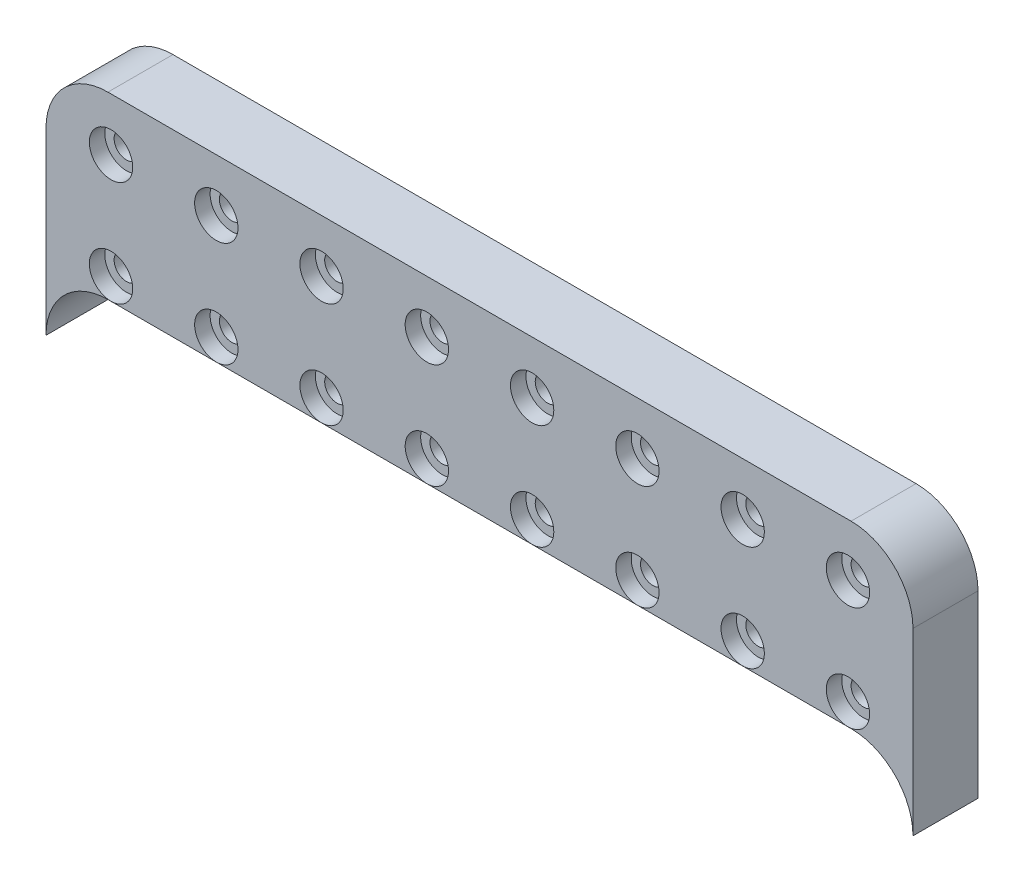
from build123d import *

# Parameters (mm, degrees)
SKIZZE1_W                        = 140
SKIZZE1_H                        = 180
AUFSATZ_LINEAR_AUSTRAGEN1_DEPTH  = 10.5
SKIZZE2_R                        = 3.5
SCHNITT_LINEAR_AUSTRAGEN3_DEPTH  = 2.5
SKIZZE3_R                        = 2
SCHNITT_LINEAR_AUSTRAGEN5_DEPTH  = 229.276696139
VERRUNDUNG1_R                    = 10
SCHNITT_LINEAR_AUSTRAGEN17_DEPTH = 229.276696139


with BuildPart() as part:
    # Skizze1 → Aufsatz-Linear austragen1 (new body)
    with BuildSketch(Plane.XY):
        with Locations((70, 90)):
            Rectangle(SKIZZE1_W, SKIZZE1_H)
    extrude(amount=AUFSATZ_LINEAR_AUSTRAGEN1_DEPTH)

    # Skizze2 → Schnitt-Linear austragen3 (cut)
    with BuildSketch(Plane.XY.offset(10.5)):
        with Locations((10.5, 183.5)):
            Circle(SKIZZE2_R)
        with Locations((27.5, 183.5)):
            Circle(SKIZZE2_R)
        with Locations((44.5, 183.5)):
            Circle(SKIZZE2_R)
        with Locations((61.5, 183.5)):
            Circle(SKIZZE2_R)
        with Locations((78.5, 183.5)):
            Circle(SKIZZE2_R)
        with Locations((95.5, 183.5)):
            Circle(SKIZZE2_R)
        with Locations((112.5, 183.5)):
            Circle(SKIZZE2_R)
        with Locations((129.5, 183.5)):
            Circle(SKIZZE2_R)
        with Locations((27.5, 166.5)):
            Circle(SKIZZE2_R)
        with Locations((44.5, 166.5)):
            Circle(SKIZZE2_R)
        with Locations((61.5, 166.5)):
            Circle(SKIZZE2_R)
        with Locations((78.5, 166.5)):
            Circle(SKIZZE2_R)
        with Locations((95.5, 166.5)):
            Circle(SKIZZE2_R)
        with Locations((112.5, 166.5)):
            Circle(SKIZZE2_R)
        with Locations((129.5, 166.5)):
            Circle(SKIZZE2_R)
        with Locations((27.5, 149.5)):
            Circle(SKIZZE2_R)
        with Locations((44.5, 149.5)):
            Circle(SKIZZE2_R)
        with Locations((61.5, 149.5)):
            Circle(SKIZZE2_R)
        with Locations((78.5, 149.5)):
            Circle(SKIZZE2_R)
        with Locations((95.5, 149.5)):
            Circle(SKIZZE2_R)
        with Locations((112.5, 149.5)):
            Circle(SKIZZE2_R)
        with Locations((129.5, 149.5)):
            Circle(SKIZZE2_R)
        with Locations((27.5, 132.5)):
            Circle(SKIZZE2_R)
        with Locations((44.5, 132.5)):
            Circle(SKIZZE2_R)
        with Locations((61.5, 132.5)):
            Circle(SKIZZE2_R)
        with Locations((78.5, 132.5)):
            Circle(SKIZZE2_R)
        with Locations((95.5, 132.5)):
            Circle(SKIZZE2_R)
        with Locations((112.5, 132.5)):
            Circle(SKIZZE2_R)
        with Locations((129.5, 132.5)):
            Circle(SKIZZE2_R)
        with Locations((27.5, 115.5)):
            Circle(SKIZZE2_R)
        with Locations((44.5, 115.5)):
            Circle(SKIZZE2_R)
        with Locations((61.5, 115.5)):
            Circle(SKIZZE2_R)
        with Locations((78.5, 115.5)):
            Circle(SKIZZE2_R)
        with Locations((95.5, 115.5)):
            Circle(SKIZZE2_R)
        with Locations((112.5, 115.5)):
            Circle(SKIZZE2_R)
        with Locations((129.5, 115.5)):
            Circle(SKIZZE2_R)
        with Locations((27.5, 98.5)):
            Circle(SKIZZE2_R)
        with Locations((44.5, 98.5)):
            Circle(SKIZZE2_R)
        with Locations((61.5, 98.5)):
            Circle(SKIZZE2_R)
        with Locations((78.5, 98.5)):
            Circle(SKIZZE2_R)
        with Locations((95.5, 98.5)):
            Circle(SKIZZE2_R)
        with Locations((112.5, 98.5)):
            Circle(SKIZZE2_R)
        with Locations((129.5, 98.5)):
            Circle(SKIZZE2_R)
        with Locations((27.5, 81.5)):
            Circle(SKIZZE2_R)
        with Locations((44.5, 81.5)):
            Circle(SKIZZE2_R)
        with Locations((61.5, 81.5)):
            Circle(SKIZZE2_R)
        with Locations((78.5, 81.5)):
            Circle(SKIZZE2_R)
        with Locations((95.5, 81.5)):
            Circle(SKIZZE2_R)
        with Locations((112.5, 81.5)):
            Circle(SKIZZE2_R)
        with Locations((129.5, 81.5)):
            Circle(SKIZZE2_R)
        with Locations((27.5, 64.5)):
            Circle(SKIZZE2_R)
        with Locations((44.5, 64.5)):
            Circle(SKIZZE2_R)
        with Locations((61.5, 64.5)):
            Circle(SKIZZE2_R)
        with Locations((78.5, 64.5)):
            Circle(SKIZZE2_R)
        with Locations((95.5, 64.5)):
            Circle(SKIZZE2_R)
        with Locations((112.5, 64.5)):
            Circle(SKIZZE2_R)
        with Locations((129.5, 64.5)):
            Circle(SKIZZE2_R)
        with Locations((27.5, 47.5)):
            Circle(SKIZZE2_R)
        with Locations((44.5, 47.5)):
            Circle(SKIZZE2_R)
        with Locations((61.5, 47.5)):
            Circle(SKIZZE2_R)
        with Locations((78.5, 47.5)):
            Circle(SKIZZE2_R)
        with Locations((95.5, 47.5)):
            Circle(SKIZZE2_R)
        with Locations((112.5, 47.5)):
            Circle(SKIZZE2_R)
        with Locations((129.5, 47.5)):
            Circle(SKIZZE2_R)
        with Locations((27.5, 30.5)):
            Circle(SKIZZE2_R)
        with Locations((44.5, 30.5)):
            Circle(SKIZZE2_R)
        with Locations((61.5, 30.5)):
            Circle(SKIZZE2_R)
        with Locations((78.5, 30.5)):
            Circle(SKIZZE2_R)
        with Locations((95.5, 30.5)):
            Circle(SKIZZE2_R)
        with Locations((112.5, 30.5)):
            Circle(SKIZZE2_R)
        with Locations((129.5, 30.5)):
            Circle(SKIZZE2_R)
        with Locations((27.5, 13.5)):
            Circle(SKIZZE2_R)
        with Locations((44.5, 13.5)):
            Circle(SKIZZE2_R)
        with Locations((61.5, 13.5)):
            Circle(SKIZZE2_R)
        with Locations((78.5, 13.5)):
            Circle(SKIZZE2_R)
        with Locations((95.5, 13.5)):
            Circle(SKIZZE2_R)
        with Locations((112.5, 13.5)):
            Circle(SKIZZE2_R)
        with Locations((129.5, 13.5)):
            Circle(SKIZZE2_R)
        with Locations((10.5, 166.5)):
            Circle(SKIZZE2_R)
        with Locations((10.5, 149.5)):
            Circle(SKIZZE2_R)
        with Locations((10.5, 132.5)):
            Circle(SKIZZE2_R)
        with Locations((10.5, 115.5)):
            Circle(SKIZZE2_R)
        with Locations((10.5, 98.5)):
            Circle(SKIZZE2_R)
        with Locations((10.5, 81.5)):
            Circle(SKIZZE2_R)
        with Locations((10.5, 64.5)):
            Circle(SKIZZE2_R)
        with Locations((10.5, 47.5)):
            Circle(SKIZZE2_R)
        with Locations((10.5, 30.5)):
            Circle(SKIZZE2_R)
        with Locations((10.5, 13.5)):
            Circle(SKIZZE2_R)
    extrude(amount=-SCHNITT_LINEAR_AUSTRAGEN3_DEPTH, mode=Mode.SUBTRACT)

    # Skizze3 → Schnitt-Linear austragen5 (cut, through all)
    with BuildSketch(Plane.XY):
        with Locations((10.5, 183.5)):
            Circle(SKIZZE3_R)
        with Locations((27.5, 183.5)):
            Circle(SKIZZE3_R)
        with Locations((44.5, 183.5)):
            Circle(SKIZZE3_R)
        with Locations((61.5, 183.5)):
            Circle(SKIZZE3_R)
        with Locations((78.5, 183.5)):
            Circle(SKIZZE3_R)
        with Locations((95.5, 183.5)):
            Circle(SKIZZE3_R)
        with Locations((112.5, 183.5)):
            Circle(SKIZZE3_R)
        with Locations((129.5, 183.5)):
            Circle(SKIZZE3_R)
        with Locations(Location((27.5, 166.5, 0), (0, 0, 180))):
            Circle(SKIZZE3_R)
        with Locations(Location((44.5, 166.5, 0), (0, 0, 180))):
            Circle(SKIZZE3_R)
        with Locations(Location((61.5, 166.5, 0), (0, 0, 180))):
            Circle(SKIZZE3_R)
        with Locations(Location((78.5, 166.5, 0), (0, 0, 180))):
            Circle(SKIZZE3_R)
        with Locations(Location((95.5, 166.5, 0), (0, 0, 180))):
            Circle(SKIZZE3_R)
        with Locations(Location((112.5, 166.5, 0), (0, 0, 180))):
            Circle(SKIZZE3_R)
        with Locations(Location((129.5, 166.5, 0), (0, 0, 180))):
            Circle(SKIZZE3_R)
        with Locations(Location((27.5, 149.5, 0), (0, 0, 180))):
            Circle(SKIZZE3_R)
        with Locations(Location((44.5, 149.5, 0), (0, 0, 180))):
            Circle(SKIZZE3_R)
        with Locations(Location((61.5, 149.5, 0), (0, 0, 180))):
            Circle(SKIZZE3_R)
        with Locations(Location((78.5, 149.5, 0), (0, 0, 180))):
            Circle(SKIZZE3_R)
        with Locations(Location((95.5, 149.5, 0), (0, 0, 180))):
            Circle(SKIZZE3_R)
        with Locations(Location((112.5, 149.5, 0), (0, 0, 180))):
            Circle(SKIZZE3_R)
        with Locations(Location((129.5, 149.5, 0), (0, 0, 180))):
            Circle(SKIZZE3_R)
        with Locations(Location((27.5, 132.5, 0), (0, 0, 180))):
            Circle(SKIZZE3_R)
        with Locations(Location((44.5, 132.5, 0), (0, 0, 180))):
            Circle(SKIZZE3_R)
        with Locations(Location((61.5, 132.5, 0), (0, 0, 180))):
            Circle(SKIZZE3_R)
        with Locations(Location((78.5, 132.5, 0), (0, 0, 180))):
            Circle(SKIZZE3_R)
        with Locations(Location((95.5, 132.5, 0), (0, 0, 180))):
            Circle(SKIZZE3_R)
        with Locations(Location((112.5, 132.5, 0), (0, 0, 180))):
            Circle(SKIZZE3_R)
        with Locations(Location((129.5, 132.5, 0), (0, 0, 180))):
            Circle(SKIZZE3_R)
        with Locations(Location((27.5, 115.5, 0), (0, 0, 180))):
            Circle(SKIZZE3_R)
        with Locations(Location((44.5, 115.5, 0), (0, 0, 180))):
            Circle(SKIZZE3_R)
        with Locations(Location((61.5, 115.5, 0), (0, 0, 180))):
            Circle(SKIZZE3_R)
        with Locations(Location((78.5, 115.5, 0), (0, 0, 180))):
            Circle(SKIZZE3_R)
        with Locations(Location((95.5, 115.5, 0), (0, 0, 180))):
            Circle(SKIZZE3_R)
        with Locations(Location((112.5, 115.5, 0), (0, 0, 180))):
            Circle(SKIZZE3_R)
        with Locations(Location((129.5, 115.5, 0), (0, 0, 180))):
            Circle(SKIZZE3_R)
        with Locations(Location((27.5, 98.5, 0), (0, 0, 180))):
            Circle(SKIZZE3_R)
        with Locations(Location((44.5, 98.5, 0), (0, 0, 180))):
            Circle(SKIZZE3_R)
        with Locations(Location((61.5, 98.5, 0), (0, 0, 180))):
            Circle(SKIZZE3_R)
        with Locations(Location((78.5, 98.5, 0), (0, 0, 180))):
            Circle(SKIZZE3_R)
        with Locations(Location((95.5, 98.5, 0), (0, 0, 180))):
            Circle(SKIZZE3_R)
        with Locations(Location((112.5, 98.5, 0), (0, 0, 180))):
            Circle(SKIZZE3_R)
        with Locations(Location((129.5, 98.5, 0), (0, 0, 180))):
            Circle(SKIZZE3_R)
        with Locations(Location((27.5, 81.5, 0), (0, 0, 180))):
            Circle(SKIZZE3_R)
        with Locations(Location((44.5, 81.5, 0), (0, 0, 180))):
            Circle(SKIZZE3_R)
        with Locations(Location((61.5, 81.5, 0), (0, 0, 180))):
            Circle(SKIZZE3_R)
        with Locations(Location((78.5, 81.5, 0), (0, 0, 180))):
            Circle(SKIZZE3_R)
        with Locations(Location((95.5, 81.5, 0), (0, 0, 180))):
            Circle(SKIZZE3_R)
        with Locations(Location((112.5, 81.5, 0), (0, 0, 180))):
            Circle(SKIZZE3_R)
        with Locations(Location((129.5, 81.5, 0), (0, 0, 180))):
            Circle(SKIZZE3_R)
        with Locations(Location((27.5, 64.5, 0), (0, 0, 180))):
            Circle(SKIZZE3_R)
        with Locations(Location((44.5, 64.5, 0), (0, 0, 180))):
            Circle(SKIZZE3_R)
        with Locations(Location((61.5, 64.5, 0), (0, 0, 180))):
            Circle(SKIZZE3_R)
        with Locations(Location((78.5, 64.5, 0), (0, 0, 180))):
            Circle(SKIZZE3_R)
        with Locations(Location((95.5, 64.5, 0), (0, 0, 180))):
            Circle(SKIZZE3_R)
        with Locations(Location((112.5, 64.5, 0), (0, 0, 180))):
            Circle(SKIZZE3_R)
        with Locations(Location((129.5, 64.5, 0), (0, 0, 180))):
            Circle(SKIZZE3_R)
        with Locations(Location((27.5, 47.5, 0), (0, 0, 180))):
            Circle(SKIZZE3_R)
        with Locations(Location((44.5, 47.5, 0), (0, 0, 180))):
            Circle(SKIZZE3_R)
        with Locations(Location((61.5, 47.5, 0), (0, 0, 180))):
            Circle(SKIZZE3_R)
        with Locations(Location((78.5, 47.5, 0), (0, 0, 180))):
            Circle(SKIZZE3_R)
        with Locations(Location((95.5, 47.5, 0), (0, 0, 180))):
            Circle(SKIZZE3_R)
        with Locations(Location((112.5, 47.5, 0), (0, 0, 180))):
            Circle(SKIZZE3_R)
        with Locations(Location((129.5, 47.5, 0), (0, 0, 180))):
            Circle(SKIZZE3_R)
        with Locations(Location((27.5, 30.5, 0), (0, 0, 180))):
            Circle(SKIZZE3_R)
        with Locations(Location((44.5, 30.5, 0), (0, 0, 180))):
            Circle(SKIZZE3_R)
        with Locations(Location((61.5, 30.5, 0), (0, 0, 180))):
            Circle(SKIZZE3_R)
        with Locations(Location((78.5, 30.5, 0), (0, 0, 180))):
            Circle(SKIZZE3_R)
        with Locations(Location((95.5, 30.5, 0), (0, 0, 180))):
            Circle(SKIZZE3_R)
        with Locations(Location((112.5, 30.5, 0), (0, 0, 180))):
            Circle(SKIZZE3_R)
        with Locations(Location((129.5, 30.5, 0), (0, 0, 180))):
            Circle(SKIZZE3_R)
        with Locations(Location((27.5, 13.5, 0), (0, 0, 180))):
            Circle(SKIZZE3_R)
        with Locations(Location((44.5, 13.5, 0), (0, 0, 180))):
            Circle(SKIZZE3_R)
        with Locations(Location((61.5, 13.5, 0), (0, 0, 180))):
            Circle(SKIZZE3_R)
        with Locations(Location((78.5, 13.5, 0), (0, 0, 180))):
            Circle(SKIZZE3_R)
        with Locations(Location((95.5, 13.5, 0), (0, 0, 180))):
            Circle(SKIZZE3_R)
        with Locations(Location((112.5, 13.5, 0), (0, 0, 180))):
            Circle(SKIZZE3_R)
        with Locations(Location((129.5, 13.5, 0), (0, 0, 180))):
            Circle(SKIZZE3_R)
        with Locations((27.5, -3.5)):
            Circle(SKIZZE3_R)
        with Locations((44.5, -3.5)):
            Circle(SKIZZE3_R)
        with Locations((61.5, -3.5)):
            Circle(SKIZZE3_R)
        with Locations((78.5, -3.5)):
            Circle(SKIZZE3_R)
        with Locations((95.5, -3.5)):
            Circle(SKIZZE3_R)
        with Locations((112.5, -3.5)):
            Circle(SKIZZE3_R)
        with Locations((129.5, -3.5)):
            Circle(SKIZZE3_R)
        with Locations(Location((10.5, 166.5, 0), (0, 0, 180))):
            Circle(SKIZZE3_R)
        with Locations(Location((10.5, 149.5, 0), (0, 0, 180))):
            Circle(SKIZZE3_R)
        with Locations(Location((10.5, 132.5, 0), (0, 0, 180))):
            Circle(SKIZZE3_R)
        with Locations(Location((10.5, 115.5, 0), (0, 0, 180))):
            Circle(SKIZZE3_R)
        with Locations(Location((10.5, 98.5, 0), (0, 0, 180))):
            Circle(SKIZZE3_R)
        with Locations(Location((10.5, 81.5, 0), (0, 0, 180))):
            Circle(SKIZZE3_R)
        with Locations(Location((10.5, 64.5, 0), (0, 0, 180))):
            Circle(SKIZZE3_R)
        with Locations(Location((10.5, 47.5, 0), (0, 0, 180))):
            Circle(SKIZZE3_R)
        with Locations(Location((10.5, 30.5, 0), (0, 0, 180))):
            Circle(SKIZZE3_R)
        with Locations(Location((10.5, 13.5, 0), (0, 0, 180))):
            Circle(SKIZZE3_R)
        with Locations((10.5, -3.5)):
            Circle(SKIZZE3_R)
    extrude(amount=SCHNITT_LINEAR_AUSTRAGEN5_DEPTH, mode=Mode.SUBTRACT)

    # Verrundung1
    verrundung1_edges = [part.edges().sort_by_distance(p)[0] for p in [
        (0, 180, 5.25),
        (140, 180, 5.25),
        (140, 0, 5.25),
        (0, 0, 5.25),
    ]]
    fillet(verrundung1_edges, radius=VERRUNDUNG1_R)

    # Skizze7 → Schnitt-Linear austragen17 (cut, through all)
    with BuildSketch(Plane.XY.offset(10.5)):
        with BuildLine():
            Line((10, 145.99), (130, 145.99))
            ThreePointArc((130, 145.99), (137.071067812, 143.061067812), (140, 135.99))
            Line((140, 135.99), (140, -23.696041725))
            Line((140, -23.696041725), (0, -21.145959103))
            Line((0, -21.145959103), (0, 135.99))
            ThreePointArc((0, 135.99), (2.928932188, 143.061067812), (10, 145.99))
        make_face()
        with BuildLine():
            Line((10, 175), (130, 175))
            ThreePointArc((130, 175), (137.071067812, 172.071067812), (140, 165))
            Line((140, 165), (140, 196.015375314))
            Line((140, 196.015375314), (0, 196.015375314))
            Line((0, 196.015375314), (0, 165))
            ThreePointArc((0, 165), (2.928932188, 172.071067812), (10, 175))
        make_face()
    extrude(amount=-SCHNITT_LINEAR_AUSTRAGEN17_DEPTH, mode=Mode.SUBTRACT)


solid = part.part
